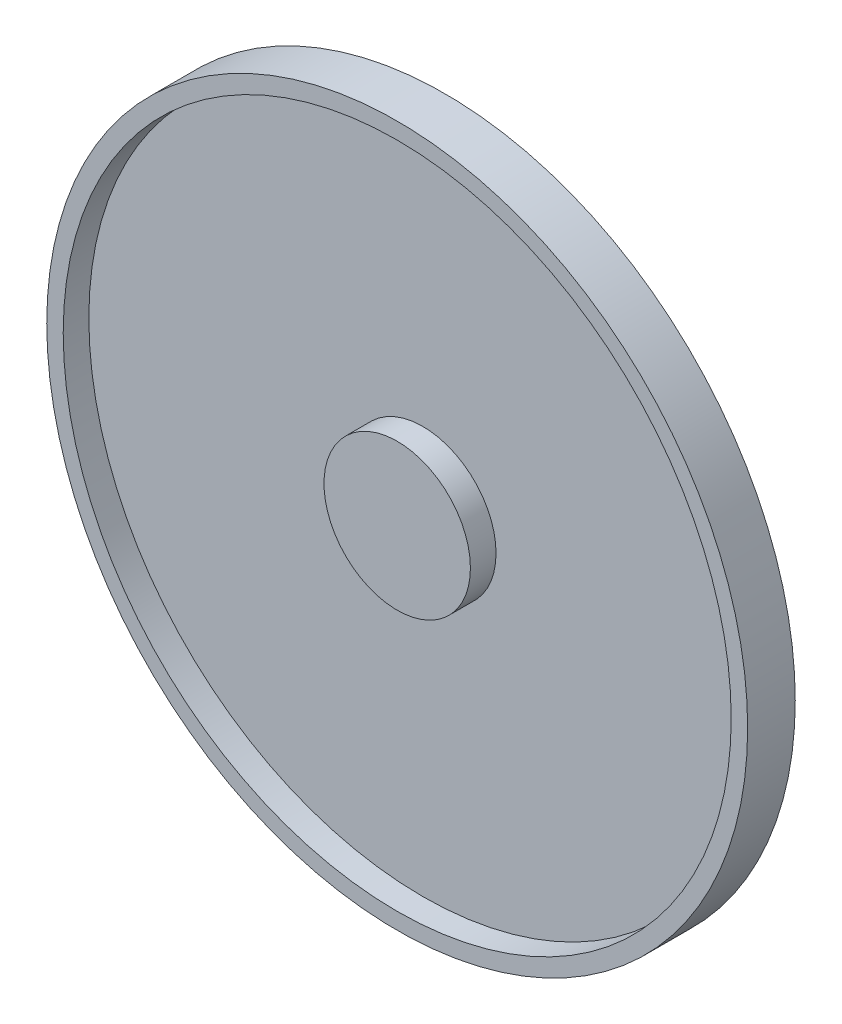
from build123d import *

# Parameters (mm, degrees)
SKETCH1_R           = 478.75
BOSS_EXTRUDE1_DEPTH = 65
SKETCH2_R           = 456.25
SKETCH2_R_2         = 100
CUT_EXTRUDE1_DEPTH  = 35


with BuildPart() as part:
    # Sketch1 → Boss-Extrude1 (new body)
    with BuildSketch(Plane.XY):
        Circle(SKETCH1_R)
    extrude(amount=-BOSS_EXTRUDE1_DEPTH)

    # Sketch2 → Cut-Extrude1 (cut)
    with BuildSketch(Plane.XY):
        Circle(SKETCH2_R)
        Circle(SKETCH2_R_2, mode=Mode.SUBTRACT)
    extrude(amount=-CUT_EXTRUDE1_DEPTH, mode=Mode.SUBTRACT)


solid = part.part
